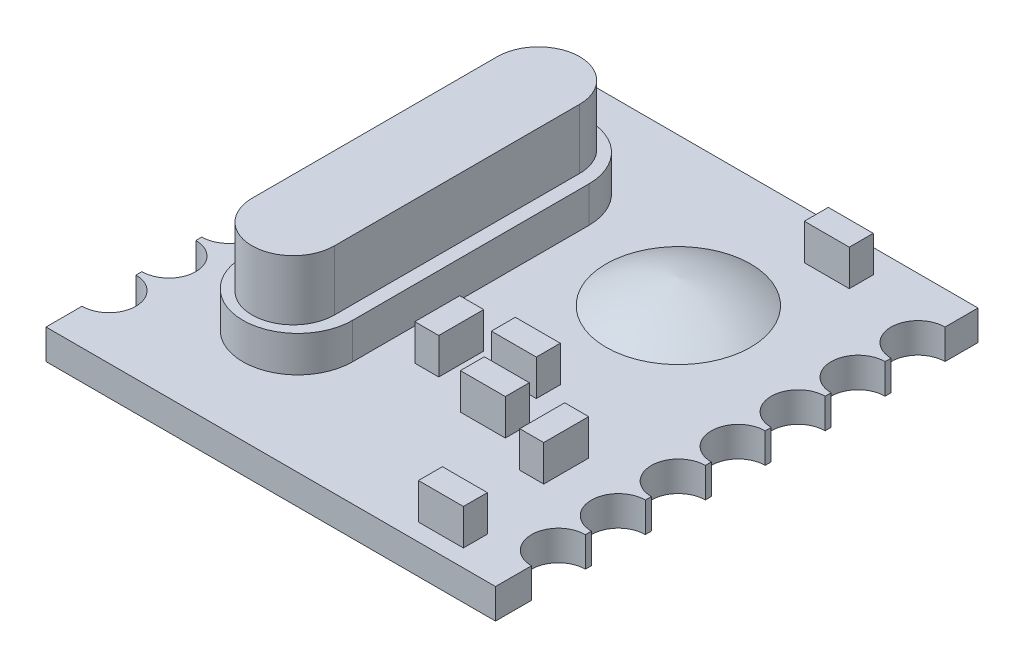
from build123d import *

# Parameters (mm, degrees)
SKETCH1_W            = 15
SKETCH1_H            = 16.1
BOSS_EXTRUDE1_DEPTH  = 1
CUT_EXTRUDE2_DEPTH   = 1
LPATTERN1_COUNT      = 7
LPATTERN1_PITCH      = 2
MIRROR1_COPY_1_DEPTH = 1
MIRROR1_COPY_2_DEPTH = 1
MIRROR1_COPY_3_DEPTH = 1
MIRROR1_COPY_4_DEPTH = 1
MIRROR1_COPY_5_DEPTH = 1
MIRROR1_COPY_6_DEPTH = 1
BOSS_EXTRUDE2_DEPTH  = 1.2
BOSS_EXTRUDE3_DEPTH  = 2
SKETCH5_W            = 0.8
SKETCH5_H            = 1.5
SKETCH5_W_2          = 1.5
SKETCH5_H_2          = 0.8
BOSS_EXTRUDE4_DEPTH  = 1.2


with BuildPart() as part:
    # Sketch1 → Boss-Extrude1 (new body)
    with BuildSketch(Plane(origin=(0, 0, 0), x_dir=(1, 0, 0), z_dir=(0, 1, 0))):
        Rectangle(SKETCH1_W, SKETCH1_H)
    extrude(amount=BOSS_EXTRUDE1_DEPTH)

    # Sketch2 → Cut-Extrude2 (cut)
    with BuildSketch(Plane(origin=(0, 1, 0), x_dir=(1, 0, 0), z_dir=(0, 1, 0))):
        with BuildLine():
            Line((-7.5, 5.15), (-7.5, 6.95))
            ThreePointArc((-7.5, 6.95), (-6.6, 6.05), (-7.5, 5.15))
        make_face()
    cut_extrude2 = extrude(amount=-CUT_EXTRUDE2_DEPTH, mode=Mode.SUBTRACT)

    # LPattern1: Cut-Extrude2 ×7
    with Locations(*[(0, 0, i * LPATTERN1_PITCH) for i in range(1, LPATTERN1_COUNT)]):
        add(cut_extrude2, mode=Mode.SUBTRACT)

    # Mirror1: Cut-Extrude2 across plane
    add(cut_extrude2.mirror(Plane(origin=(0, 0, 0), x_dir=(0, 0, 1), z_dir=(1, 0, 0))), mode=Mode.SUBTRACT)

    # Mirror1 copy 1 sketch → Mirror1 copy 1 (cut)
    with BuildSketch(Plane(origin=(0, 1, 2), x_dir=(-1, 0, 0), z_dir=(0, 1, 0))):
        with BuildLine():
            Line((-7.5, -5.15), (-7.5, -6.95))
            ThreePointArc((-7.5, -6.95), (-6.6, -6.05), (-7.5, -5.15))
        make_face()
    extrude(amount=-MIRROR1_COPY_1_DEPTH, mode=Mode.SUBTRACT)

    # Mirror1 copy 2 sketch → Mirror1 copy 2 (cut)
    with BuildSketch(Plane(origin=(0, 1, 4), x_dir=(-1, 0, 0), z_dir=(0, 1, 0))):
        with BuildLine():
            Line((-7.5, -5.15), (-7.5, -6.95))
            ThreePointArc((-7.5, -6.95), (-6.6, -6.05), (-7.5, -5.15))
        make_face()
    extrude(amount=-MIRROR1_COPY_2_DEPTH, mode=Mode.SUBTRACT)

    # Mirror1 copy 3 sketch → Mirror1 copy 3 (cut)
    with BuildSketch(Plane(origin=(0, 1, 6), x_dir=(-1, 0, 0), z_dir=(0, 1, 0))):
        with BuildLine():
            Line((-7.5, -5.15), (-7.5, -6.95))
            ThreePointArc((-7.5, -6.95), (-6.6, -6.05), (-7.5, -5.15))
        make_face()
    extrude(amount=-MIRROR1_COPY_3_DEPTH, mode=Mode.SUBTRACT)

    # Mirror1 copy 4 sketch → Mirror1 copy 4 (cut)
    with BuildSketch(Plane(origin=(0, 1, 8), x_dir=(-1, 0, 0), z_dir=(0, 1, 0))):
        with BuildLine():
            Line((-7.5, -5.15), (-7.5, -6.95))
            ThreePointArc((-7.5, -6.95), (-6.6, -6.05), (-7.5, -5.15))
        make_face()
    extrude(amount=-MIRROR1_COPY_4_DEPTH, mode=Mode.SUBTRACT)

    # Mirror1 copy 5 sketch → Mirror1 copy 5 (cut)
    with BuildSketch(Plane(origin=(0, 1, 10), x_dir=(-1, 0, 0), z_dir=(0, 1, 0))):
        with BuildLine():
            Line((-7.5, -5.15), (-7.5, -6.95))
            ThreePointArc((-7.5, -6.95), (-6.6, -6.05), (-7.5, -5.15))
        make_face()
    extrude(amount=-MIRROR1_COPY_5_DEPTH, mode=Mode.SUBTRACT)

    # Mirror1 copy 6 sketch → Mirror1 copy 6 (cut)
    with BuildSketch(Plane(origin=(0, 1, 12), x_dir=(-1, 0, 0), z_dir=(0, 1, 0))):
        with BuildLine():
            Line((-7.5, -5.15), (-7.5, -6.95))
            ThreePointArc((-7.5, -6.95), (-6.6, -6.05), (-7.5, -5.15))
        make_face()
    extrude(amount=-MIRROR1_COPY_6_DEPTH, mode=Mode.SUBTRACT)

    # Sketch3 → Boss-Extrude2 (add)
    with BuildSketch(Plane(origin=(0, 1, 0), x_dir=(1, 0, 0), z_dir=(0, 1, 0))):
        with BuildLine():
            Line((-1.378145927, 3.940636009), (-1.378145927, -3.940636009))
            ThreePointArc((-1.378145927, -3.940636009), (-3.208495985, -5.770986067), (-5.038846044, -3.940636009))
            Line((-5.038846044, -3.940636009), (-5.038846044, 3.940636009))
            ThreePointArc((-5.038846044, 3.940636009), (-3.208495985, 5.770986067), (-1.378145927, 3.940636009))
        make_face()
    extrude(amount=BOSS_EXTRUDE2_DEPTH)

    # Sketch4 → Boss-Extrude3 (add)
    with BuildSketch(Plane(origin=(0, 2.2, 0), x_dir=(1, 0, 0), z_dir=(0, 1, 0))):
        with BuildLine():
            Line((-1.833495985, 4.091370719), (-1.833495985, -4.091370719))
            ThreePointArc((-1.833495985, -4.091370719), (-3.208495985, -5.466370719), (-4.583495985, -4.091370719))
            Line((-4.583495985, -4.091370719), (-4.583495985, 4.091370719))
            ThreePointArc((-4.583495985, 4.091370719), (-3.208495985, 5.466370719), (-1.833495985, 4.091370719))
        make_face()
    extrude(amount=BOSS_EXTRUDE3_DEPTH)

    # Sketch5 → Boss-Extrude4 (add)
    with BuildSketch(Plane(origin=(0, 1, 0), x_dir=(1, 0, 0), z_dir=(0, 1, 0))):
        with Locations((0.098530579, -2.192746517)):
            Rectangle(SKETCH5_W, SKETCH5_H)
        with Locations((1.998944746, -1.538017709)):
            Rectangle(SKETCH5_W_2, SKETCH5_H_2)
        with Locations((2.623417119, -3.196099527)):
            Rectangle(SKETCH5_W_2, SKETCH5_H_2)
        with Locations((4.943574852, -3.53517249)):
            Rectangle(SKETCH5_W, SKETCH5_H)
        with Locations((5.099773081, -7.072134946)):
            Rectangle(SKETCH5_W_2, SKETCH5_H_2)
        with Locations((4.044630106, 6.860059031)):
            Rectangle(SKETCH5_W_2, SKETCH5_H_2)
    extrude(amount=BOSS_EXTRUDE4_DEPTH)


with BuildPart() as body_2:
    # Sketch8 → Revolve1 (revolve)
    with BuildSketch(Plane(origin=(0, 0, -3.05), x_dir=(-1, 0, 0), z_dir=(0, 0, -1))):
        with BuildLine():
            Line((-2.5, 1.06855417), (-2.5, 1.86855417))
            add(Edge.make_bspline(
                [(-2.5, 1.86855417), (-3.790620533, 1.72620642), (-4.911731537, 1.06855417)],
                knots=[0, 0, 0, 1, 1, 1], degree=2))
            Line((-4.911731537, 1.06855417), (-2.5, 1.06855417))
        make_face()
    revolve(axis=Axis((2.5, -0.05, -3.05), (0, 1, 0)))


solid = Compound([part.part, body_2.part])
